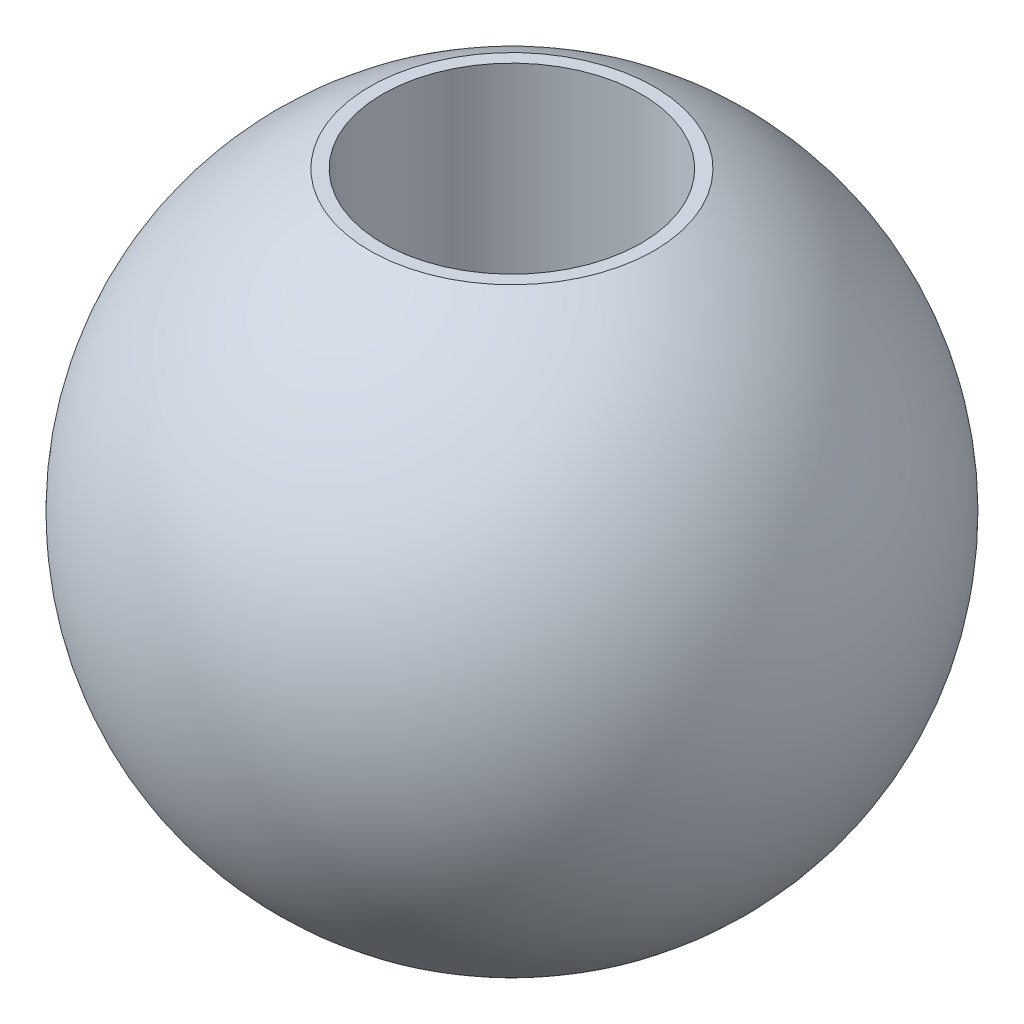
from build123d import *


with BuildPart() as part:
    # Sketch1 → Revolve1 (revolve)
    with BuildSketch(Plane.XY):
        with BuildLine():
            Line((1.1, 2.3), (1, 2.3))
            Line((1, 2.3), (1, -2.3))
            Line((1, -2.3), (1.1, -2.3))
            ThreePointArc((1.1, -2.3), (2.549509757, 0), (1.1, 2.3))
        make_face()
    revolve(axis=Axis((0, -1000, 0), (0, 1, 0)))


solid = part.part
